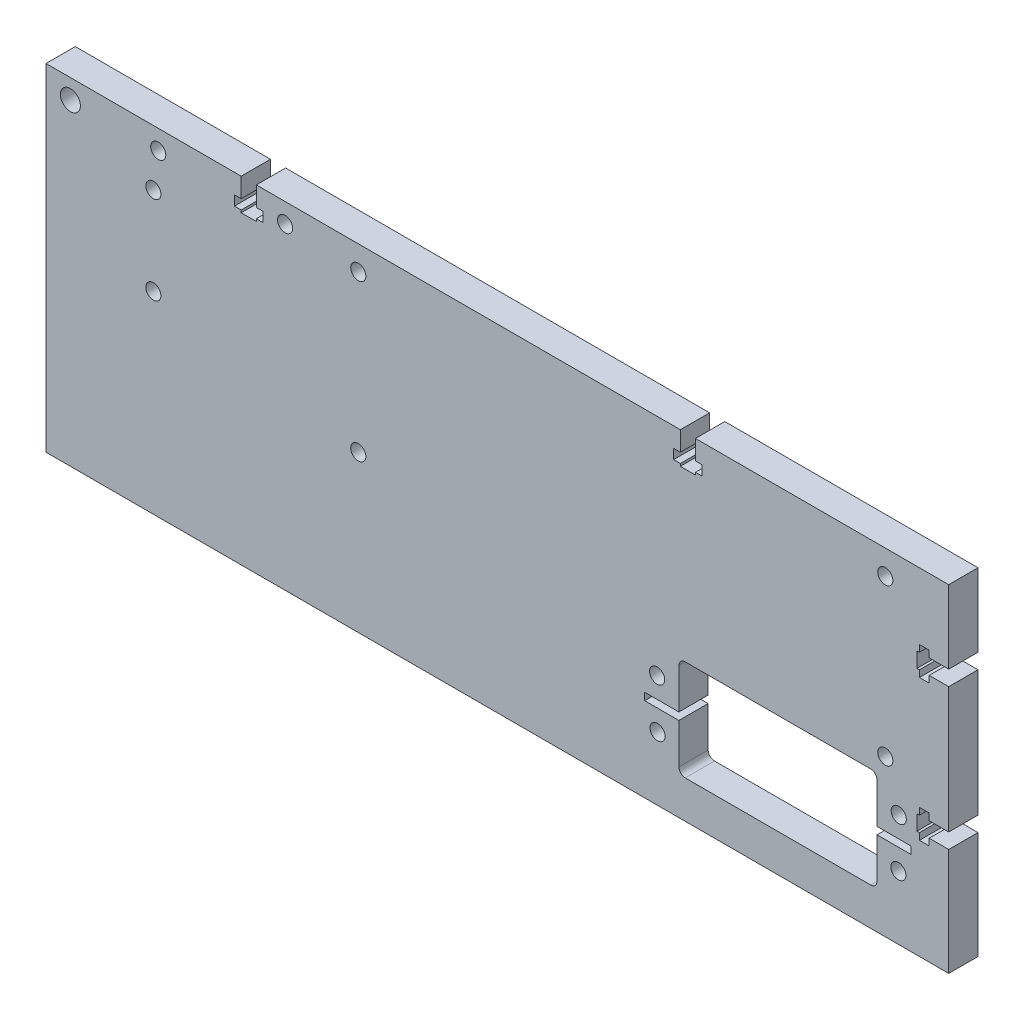
from build123d import *

# Parameters (mm, degrees)
SZKIC1_W                    = 185
SZKIC1_H                    = 69
DODANIE_WYCI_GNI_CIE1_DEPTH = 6
WYTNIJ_WYCI_GNI_CIE2_DEPTH  = 203.495320778
SZYK_LINIOWY1_COUNT         = 2
SZYK_LINIOWY1_PITCH         = 90
WYTNIJ_WYCI_GNI_CIE3_DEPTH  = 203.495320778
SZYK_LINIOWY2_COUNT         = 2
SZYK_LINIOWY2_PITCH         = 28.9
SZKIC8_R                    = 1.55
WYTNIJ_WYCI_GNI_CIE4_DEPTH  = 203.495320778
SZKIC11_R                   = 2.05
SZKIC11_R_2                 = 1.55
WYTNIJ_WYCI_GNI_CIE7_DEPTH  = 10
SZKIC13_R                   = 1.55
WYTNIJ_WYCI_GNI_CIE8_DEPTH  = 6
SZKIC14_W                   = 7
SZKIC14_H                   = 1.5
WYTNIJ_WYCI_GNI_CIE9_DEPTH  = 10
SZKIC16_R                   = 1.55
WYTNIJ_WYCI_GNI_CIE10_DEPTH = 6


with BuildPart() as part:
    # Szkic1 → Dodanie-wyciągnięcie1 (new body)
    with BuildSketch(Plane.XY):
        with Locations((-82.8, 66.684311715)):
            Rectangle(SZKIC1_W, SZKIC1_H)
    extrude(amount=-DODANIE_WYCI_GNI_CIE1_DEPTH)

    # Szkic6 → Wytnij-wyciągnięcie2 (cut, through all)
    with BuildSketch(Plane(origin=(0, 0, -6), x_dir=(-1, 0, 0), z_dir=(0, 0, -1))):
        Polygon((135.3, 101.184311715), (132.2, 101.184311715), (132.2, 97.184311715), (130.825, 97.184311715), (130.825, 95.184311715), (132.2, 95.184311715), (132.2, 94.684311715), (135.3, 94.684311715), (135.3, 95.184311715), (136.675, 95.184311715), (136.675, 97.184311715), (135.3, 97.184311715), align=None)
    wytnij_wyci_gni_cie2 = extrude(amount=-WYTNIJ_WYCI_GNI_CIE2_DEPTH, mode=Mode.SUBTRACT)

    # Szyk liniowy1: Wytnij-wyciągnięcie2 ×2
    with Locations(*[(i * SZYK_LINIOWY1_PITCH, 0, 0) for i in range(1, SZYK_LINIOWY1_COUNT)]):
        add(wytnij_wyci_gni_cie2, mode=Mode.SUBTRACT)

    # Szkic7 → Wytnij-wyciągnięcie3 (cut, through all)
    with BuildSketch(Plane(origin=(0, 0, -6), x_dir=(-1, 0, 0), z_dir=(0, 0, -1))):
        Polygon((-9.7, 86.184311715), (-9.7, 83.084311715), (-5.7, 83.084311715), (-5.7, 81.709311715), (-3.7, 81.709311715), (-3.7, 83.084311715), (-3.2, 83.084311715), (-3.2, 86.184311715), (-3.7, 86.184311715), (-3.7, 87.559311715), (-5.7, 87.559311715), (-5.7, 86.184311715), align=None)
    wytnij_wyci_gni_cie3 = extrude(amount=-WYTNIJ_WYCI_GNI_CIE3_DEPTH, mode=Mode.SUBTRACT)

    # Szyk liniowy2: Wytnij-wyciągnięcie3 ×2
    with Locations(*[(0, -i * SZYK_LINIOWY2_PITCH, 0) for i in range(1, SZYK_LINIOWY2_COUNT)]):
        add(wytnij_wyci_gni_cie3, mode=Mode.SUBTRACT)

    # Szkic8 → Wytnij-wyciągnięcie4 (cut, through all)
    with BuildSketch(Plane(origin=(0, 0, -6), x_dir=(-1, 0, 0), z_dir=(0, 0, -1))):
        with Locations((111.3, 96.184311715)):
            Circle(SZKIC8_R)
        with Locations((111.3, 64.184311715)):
            Circle(SZKIC8_R)
        with Locations((3.3, 64.184311715)):
            Circle(SZKIC8_R)
        with Locations((3.3, 96.184311715)):
            Circle(SZKIC8_R)
    extrude(amount=-WYTNIJ_WYCI_GNI_CIE4_DEPTH, mode=Mode.SUBTRACT)

    # Szkic11 → Wytnij-wyciągnięcie7 (cut)
    with BuildSketch(Plane(origin=(0, 0, -6), x_dir=(-1, 0, 0), z_dir=(0, 0, -1))):
        with Locations((170.3, 97.184311715)):
            Circle(SZKIC11_R)
        with Locations((152.3, 97.184311715)):
            Circle(SZKIC11_R_2)
        with Locations((126.3, 97.184311715)):
            Circle(SZKIC11_R_2)
    extrude(amount=-WYTNIJ_WYCI_GNI_CIE7_DEPTH, mode=Mode.SUBTRACT)

    # Szkic13 → Wytnij-wyciągnięcie8 (cut)
    with BuildSketch(Plane(origin=(0, 0, -6), x_dir=(-1, 0, 0), z_dir=(0, 0, -1))):
        with Locations((49.977029411, 45.18796276)):
            Circle(SZKIC13_R)
        with Locations((50.06, 55.184311715)):
            Circle(SZKIC13_R)
        with Locations((0.54, 55.184311715)):
            Circle(SZKIC13_R)
        with Locations((0.622970589, 45.18796276)):
            Circle(SZKIC13_R)
        with BuildLine():
            Line((6.3, 39.884311715), (44.3, 39.884311715))
            ThreePointArc((44.3, 39.884311715), (45.219238816, 40.265072899), (45.6, 41.184311715))
            Line((45.6, 41.184311715), (45.6, 59.184311715))
            ThreePointArc((45.6, 59.184311715), (45.219238816, 60.10355053), (44.3, 60.484311715))
            Line((44.3, 60.484311715), (6.3, 60.484311715))
            ThreePointArc((6.3, 60.484311715), (5.380761184, 60.10355053), (5, 59.184311715))
            Line((5, 59.184311715), (5, 41.184311715))
            ThreePointArc((5, 41.184311715), (5.380761184, 40.265072899), (6.3, 39.884311715))
        make_face()
    extrude(amount=-WYTNIJ_WYCI_GNI_CIE8_DEPTH, mode=Mode.SUBTRACT)

    # Szkic14 → Wytnij-wyciągnięcie9 (cut)
    with BuildSketch(Plane(origin=(0, 0, -6), x_dir=(-1, 0, 0), z_dir=(0, 0, -1))):
        with Locations((49.1, 50.184311715)):
            Rectangle(SZKIC14_W, SZKIC14_H)
        with Locations((1.5, 50.184311715)):
            Rectangle(SZKIC14_W, SZKIC14_H)
    extrude(amount=-WYTNIJ_WYCI_GNI_CIE9_DEPTH, mode=Mode.SUBTRACT)

    # Szkic16 → Wytnij-wyciągnięcie10 (cut)
    with BuildSketch(Plane(origin=(0, 0, -6), x_dir=(-1, 0, 0), z_dir=(0, 0, -1))):
        with Locations((153.3, 89.734311715)):
            Circle(SZKIC16_R)
        with Locations((153.3, 71.734311715)):
            Circle(SZKIC16_R)
    extrude(amount=-WYTNIJ_WYCI_GNI_CIE10_DEPTH, mode=Mode.SUBTRACT)


solid = part.part
